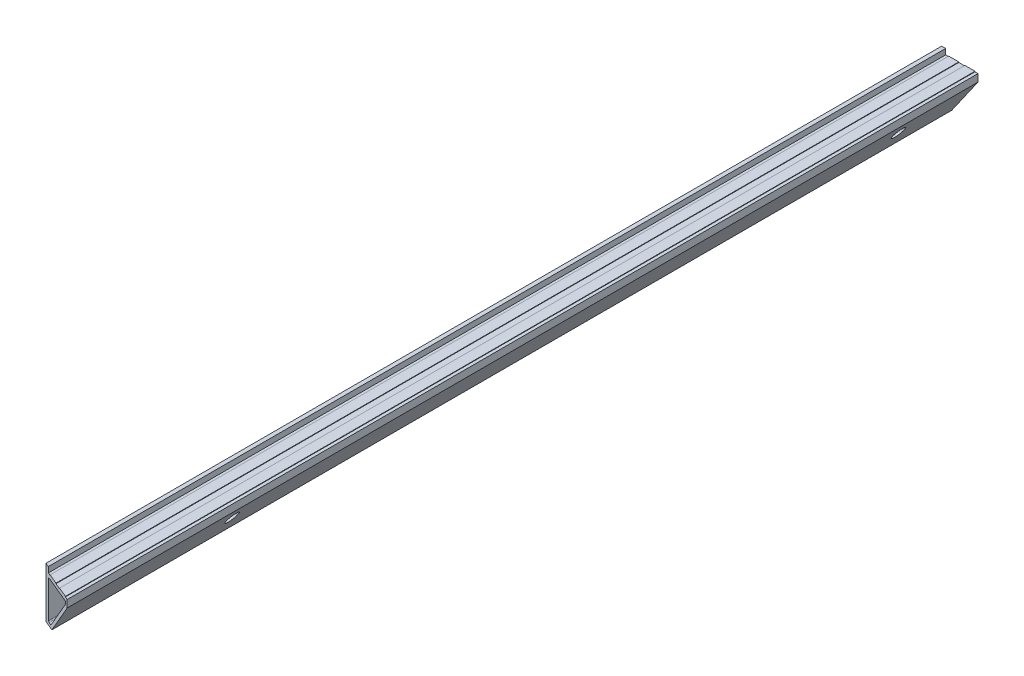
from build123d import *

# Parameters (mm, degrees)
EXTRUDE_1_DEPTH        = 901
HOLE_WIZARD_7_0_7_1_D  = 7
CUT_EXTRUDE_2_REACH    = 904.841
SKETCH_5_R             = 6
HOLE_WIZARD_M5_1_D     = 5
HOLE_WIZARD_M5_1_DEPTH = 4.5
HOLE_WIZARD_M5_2_D     = 5
HOLE_WIZARD_M5_2_DEPTH = 4.5
CUT_EXTRUDE_3_DEPTH    = 904.104091453


with BuildPart() as part:
    # 草图1 → 凸台-拉伸1 (new body)
    with BuildSketch(Plane.XY):
        Polygon((36, -0.5), (36, -7.842615501), (10, -45), (0, -45), (0, 0), (0, 5), (4, 5), (4, -0.5), (7, -0.5), (7, 0), (17, 0), (17, -0.5), (23, -0.5), (23, 0), (33, 0), (33, -0.5), align=None)
        with BuildLine():
            Line((33, -5), (33, -6.582130473))
            ThreePointArc((33, -6.582130473), (32.953765498, -6.882682255), (32.819337252, -7.155442314))
            Line((32.819337252, -7.155442314), (8.736247988, -41.573311842))
            ThreePointArc((8.736247988, -41.573311842), (8.378802584, -41.886936255), (7.916910736, -42))
            Line((7.916910736, -42), (5.5, -42))
            ThreePointArc((5.5, -42), (4.792893219, -41.707106781), (4.5, -41))
            Line((4.5, -41), (4.5, -5))
            ThreePointArc((4.5, -5), (4.792893219, -4.292893219), (5.5, -4))
            Line((5.5, -4), (32, -4))
            ThreePointArc((32, -4), (32.707106781, -4.292893219), (33, -5))
        make_face(mode=Mode.SUBTRACT)
    extrude(amount=EXTRUDE_1_DEPTH)

    # Ø7.0 (7) 直径孔1 (through all)
    with Locations(Plane.ZY):
        with Locations((68.68, -22), (727.88, -22)):
            Hole(HOLE_WIZARD_7_0_7_1_D / 2)

    # 切除-拉伸2: up to this plane
    cut_extrude_2_end = Plane(origin=(32.819337252, -7.155442314, 901), z_dir=(-0.8193372517042258, 0.5733118418188885, 0))
    # 草图5 → 切除-拉伸2 (cut, up to the surface)
    with BuildSketch(Plane(origin=(36, 0, 0), x_dir=(0, 0, -1), z_dir=(1, 0, 0)), mode=Mode.PRIVATE) as cut_extrude_2_sk1:
        with Locations(Location((-68.68, -22.072492254, 0), (0, 0, 90))):
            Circle(SKETCH_5_R)
    cut_extrude_2_tool1 = split(extrude(cut_extrude_2_sk1.sketch, amount=-CUT_EXTRUDE_2_REACH, mode=Mode.PRIVATE), bisect_by=cut_extrude_2_end, keep=Keep.BOTH, mode=Mode.PRIVATE)
    add(cut_extrude_2_tool1.solids().sort_by_distance((36, -22.072492, 68.68))[0], mode=Mode.SUBTRACT)
    # 草图5 → 切除-拉伸2 (cut, up to the surface)
    with BuildSketch(Plane(origin=(36, 0, 0), x_dir=(0, 0, -1), z_dir=(1, 0, 0)), mode=Mode.PRIVATE) as cut_extrude_2_sk2:
        with Locations(Location((-727.88, -22, 0), (0, 0, 90))):
            Circle(SKETCH_5_R)
    cut_extrude_2_tool2 = split(extrude(cut_extrude_2_sk2.sketch, amount=-CUT_EXTRUDE_2_REACH, mode=Mode.PRIVATE), bisect_by=cut_extrude_2_end, keep=Keep.BOTH, mode=Mode.PRIVATE)
    add(cut_extrude_2_tool2.solids().sort_by_distance((36, -22, 727.88))[0], mode=Mode.SUBTRACT)

    # M5 螺纹孔1
    with Locations(Plane.ZY):
        with Locations((18.636598419, -11.935996902), (18.636598419, -32), (118.675555099, -11.935996902), (118.675555099, -32)):
            Hole(HOLE_WIZARD_M5_1_D / 2, depth=HOLE_WIZARD_M5_1_DEPTH)

    # M5 螺纹孔2
    with Locations(Plane.ZY):
        with Locations((703.88, -12), (751.88, -12), (751.88, -32), (703.88, -32)):
            Hole(HOLE_WIZARD_M5_2_D / 2, depth=HOLE_WIZARD_M5_2_DEPTH)

    # 草图11 → 切除-拉伸3 (cut, through all)
    with BuildSketch(Plane(origin=(0, 5, 0), x_dir=(1, 0, 0), z_dir=(0, 1, 0))):
        Polygon((36, -901), (0, -885.940873789), (0, -901), align=None)
    extrude(amount=-CUT_EXTRUDE_3_DEPTH, mode=Mode.SUBTRACT)


solid = part.part
